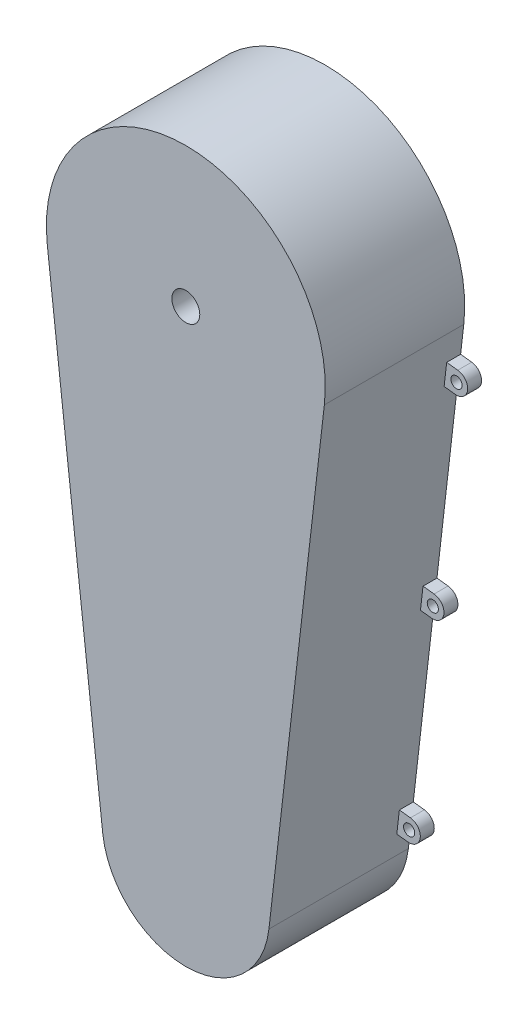
from build123d import *

# Parameters (mm, degrees)
BOSS_EXTRUDE1_DEPTH = 100
SHELL1_T            = -20
SKETCH7_R           = 10
CUT_EXTRUDE2_DEPTH  = 39
SKETCH8_R           = 4
BOSS_EXTRUDE2_DEPTH = 10
CUT_EXTRUDE3_DEPTH  = 423


with BuildPart() as part:
    # Sketch1 → Boss-Extrude1 (new body)
    with BuildSketch(Plane(origin=(0, 0, 0), x_dir=(0, 1, 0), z_dir=(0, 0, 1))):
        with BuildLine():
            Line((-356.857142857, 59.606875374), (-11.428571429, 99.34479229))
            ThreePointArc((-11.428571429, 99.34479229), (100, 0), (-11.428571429, -99.34479229))
            Line((-11.428571429, -99.34479229), (-356.857142857, -59.606875374))
            ThreePointArc((-356.857142857, -59.606875374), (-410, 0), (-356.857142857, 59.606875374))
        make_face()
    extrude(amount=BOSS_EXTRUDE1_DEPTH)

    # Shell1
    shell1_openings = [part.faces().sort_by_distance(p)[0] for p in [
        (0, -135.081480523, 0),
    ]]
    offset(amount=SHELL1_T, openings=shell1_openings, kind=Kind.INTERSECTION)

    # Sketch7 → Cut-Extrude2 (cut)
    with BuildSketch(Plane(origin=(0, 0, 80), x_dir=(1, 0, 0), z_dir=(0, 0, -1))):
        with Locations(Location((0, 0, 0), (0, 0, 180))):
            Circle(SKETCH7_R)
    extrude(amount=-CUT_EXTRUDE2_DEPTH, mode=Mode.SUBTRACT)

    # Sketch8 → Boss-Extrude2 (add)
    # profile 1 of 6: a face of its own
    with BuildSketch(Plane(origin=(0, 0, 0), x_dir=(0, 1, 0), z_dir=(0, 0, 1))):
        with BuildLine():
            Line((-342.947583383, 69.259785928), (-342.033297669, 61.312202545))
            Line((-342.033297669, 61.312202545), (-326.138130903, 63.140773973))
            Line((-326.138130903, 63.140773973), (-327.052416617, 71.088357357))
            ThreePointArc((-327.052416617, 71.088357357), (-335.914285714, 78.121655025), (-342.947583383, 69.259785928))
        make_face()
        with Locations(Location((-335, 70.174071642, 0), (0, 0, 270))):
            Circle(SKETCH8_R, mode=Mode.SUBTRACT)
    # profile 2 of 6: a face of its own
    with BuildSketch(Plane(origin=(0, 0, 0), x_dir=(0, 1, 0), z_dir=(0, 0, 1))):
        with BuildLine():
            Line((-179.552416617, 88.056677959), (-178.638130903, 80.109094575))
            Line((-178.638130903, 80.109094575), (-194.533297669, 78.280523147))
            Line((-194.533297669, 78.280523147), (-195.447583383, 86.22810653))
            ThreePointArc((-195.447583383, 86.22810653), (-188.414285714, 95.089975627), (-179.552416617, 88.056677959))
        make_face()
        with Locations(Location((-187.5, 87.142392244, 0), (0, 0, 270))):
            Circle(SKETCH8_R, mode=Mode.SUBTRACT)
    # profile 3 of 6: a face of its own
    with BuildSketch(Plane(origin=(0, 0, 0), x_dir=(0, 1, 0), z_dir=(0, 0, 1))):
        with BuildLine():
            Line((-32.052416617, 105.024998561), (-31.138130903, 97.077415177))
            Line((-31.138130903, 97.077415177), (-47.033297669, 95.248843749))
            Line((-47.033297669, 95.248843749), (-47.947583383, 103.196427132))
            ThreePointArc((-47.947583383, 103.196427132), (-40.914285714, 112.058296229), (-32.052416617, 105.024998561))
        make_face()
        with Locations(Location((-40, 104.110712846, 0), (0, 0, 270))):
            Circle(SKETCH8_R, mode=Mode.SUBTRACT)
    # profile 4 of 6: a face of its own
    with BuildSketch(Plane(origin=(0, 0, 0), x_dir=(0, 1, 0), z_dir=(0, 0, 1))):
        with BuildLine():
            Line((-47.947583383, -103.196427132), (-47.033297669, -95.248843749))
            Line((-47.033297669, -95.248843749), (-31.138130903, -97.077415177))
            Line((-31.138130903, -97.077415177), (-32.052416617, -105.024998561))
            ThreePointArc((-32.052416617, -105.024998561), (-40.914285714, -112.058296229), (-47.947583383, -103.196427132))
        make_face()
        with Locations(Location((-40, -104.110712846, 0), (0, 0, 90))):
            Circle(SKETCH8_R, mode=Mode.SUBTRACT)
    # profile 5 of 6: a face of its own
    with BuildSketch(Plane(origin=(0, 0, 0), x_dir=(0, 1, 0), z_dir=(0, 0, 1))):
        with BuildLine():
            Line((-195.447583383, -86.22810653), (-194.533297669, -78.280523147))
            Line((-194.533297669, -78.280523147), (-178.638130903, -80.109094575))
            Line((-178.638130903, -80.109094575), (-179.552416617, -88.056677959))
            ThreePointArc((-179.552416617, -88.056677959), (-188.414285714, -95.089975627), (-195.447583383, -86.22810653))
        make_face()
        with Locations(Location((-187.5, -87.142392244, 0), (0, 0, 90))):
            Circle(SKETCH8_R, mode=Mode.SUBTRACT)
    # profile 6 of 6: a face of its own
    with BuildSketch(Plane(origin=(0, 0, 0), x_dir=(0, 1, 0), z_dir=(0, 0, 1))):
        with BuildLine():
            Line((-342.033297669, -61.312202545), (-326.138130903, -63.140773973))
            Line((-326.138130903, -63.140773973), (-327.052416617, -71.088357357))
            ThreePointArc((-327.052416617, -71.088357357), (-335.914285714, -78.121655025), (-342.947583383, -69.259785928))
            Line((-342.947583383, -69.259785928), (-342.033297669, -61.312202545))
        make_face()
        with Locations(Location((-335, -70.174071642, 0), (0, 0, 90))):
            Circle(SKETCH8_R, mode=Mode.SUBTRACT)
    extrude(amount=BOSS_EXTRUDE2_DEPTH)

    # Sketch9 → Cut-Extrude3 (cut)
    with BuildSketch(Plane(origin=(0, 0, 0), x_dir=(-1, 0, 0), z_dir=(0, 1, 0))):
        with BuildLine():
            Line((0, 0), (-8, 0))
            Line((-8, 0), (-8, 10))
            ThreePointArc((-8, 10), (0, 18), (8, 10))
            Line((8, 10), (8, 0))
            Line((8, 0), (0, 0))
        make_face()
    extrude(amount=-CUT_EXTRUDE3_DEPTH, mode=Mode.SUBTRACT)


solid = part.part
